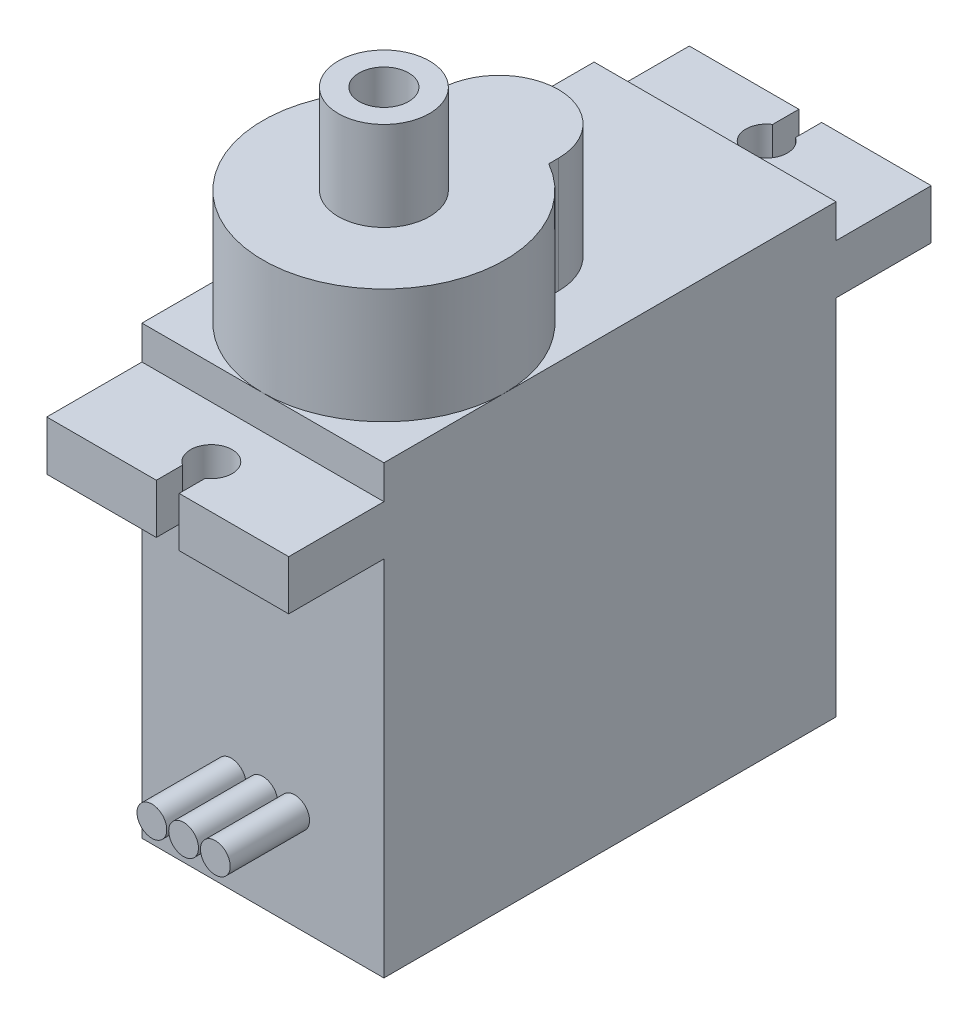
from build123d import *

# Parameters (mm, degrees)
BOSS_EXTRUDE1_DEPTH                 = 12.2
SKETCH2_R                           = 6.1
BOSS_EXTRUDE2_DEPTH                 = 5.8
BOSS_EXTRU_1_DEPTH                  = 5.8
ENL_V_MAT_EXTRU_1_DEPTH             = 30.050301203
SKETCH8_R                           = 0.75
BOSS_EXTRUDE5_DEPTH                 = 4
SKETCH3_R                           = 2.3
BOSS_EXTRUDE6_DEPTH                 = 4.5
DIAM_TRE_DU_PER_AGE_2_5_2_5_1_D     = 2.5
DIAM_TRE_DU_PER_AGE_2_5_2_5_1_DEPTH = 4
DIAM_TRE_DU_PER_AGE_2_5_2_5_1_TIP   = 0.751075774


with BuildPart() as part:
    # Sketch1 → Boss-Extrude1 (new body)
    with BuildSketch(Plane(origin=(0, 0, 0), x_dir=(0, 0, -1), z_dir=(1, 0, 0))):
        Polygon((-11.4, -11.25), (-11.4, 7.05), (-16.2, 7.05), (-16.2, 9.55), (-11.4, 9.55), (-11.4, 11.25), (11.4, 11.25), (11.4, 9.55), (16.2, 9.55), (16.2, 7.05), (11.4, 7.05), (11.4, -11.25), align=None)
    extrude(amount=BOSS_EXTRUDE1_DEPTH)

    # Sketch2 → Boss-Extrude2 (add)
    with BuildSketch(Plane(origin=(0, 11.25, 0), x_dir=(1, 0, 0), z_dir=(0, 1, 0))):
        with Locations(Location((6.1, -5.3, 0), (0, 0, 270))):
            Circle(SKETCH2_R)
    extrude(amount=BOSS_EXTRUDE2_DEPTH)

    # Sketch4 → Boss.-Extru.1 (add)
    with BuildSketch(Plane(origin=(0, 11.25, 0), x_dir=(1, 0, 0), z_dir=(0, 1, 0))):
        with BuildLine():
            Line((3.1, 0.5), (3.1, 0.01130869))
            ThreePointArc((3.1, 0.01130869), (6.1, 0.8), (9.1, 0.01130869))
            Line((9.1, 0.01130869), (9.1, 0.5))
            ThreePointArc((9.1, 0.5), (6.1, 3.5), (3.1, 0.5))
        make_face()
    extrude(amount=BOSS_EXTRU_1_DEPTH)

    # Sketch6 → Enlèv. mat.-Extru.1 (cut, through all)
    with BuildSketch(Plane(origin=(0, 9.55, 0), x_dir=(1, 0, 0), z_dir=(0, 1, 0))):
        with BuildLine():
            Line((5.525, -16.2), (6.675, -16.2))
            Line((6.675, -16.2), (6.675, -14.87856417))
            ThreePointArc((6.675, -14.87856417), (6.1, -12.95), (5.525, -14.87856417))
            Line((5.525, -14.87856417), (5.525, -16.2))
        make_face()
        with BuildLine():
            Line((5.525, 14.87856417), (5.525, 16.2))
            Line((5.525, 16.2), (6.675, 16.2))
            Line((6.675, 16.2), (6.675, 14.87856417))
            ThreePointArc((6.675, 14.87856417), (6.1, 12.95), (5.525, 14.87856417))
        make_face()
    extrude(amount=-ENL_V_MAT_EXTRU_1_DEPTH, mode=Mode.SUBTRACT)

    # Sketch8 → Boss-Extrude5 (add)
    with BuildSketch(Plane.XY.offset(11.4)):
        with Locations(Location((6.1, -6.25, 0), (0, 0, 180))):
            Circle(SKETCH8_R)
        with Locations(Location((7.7, -6.25, 0), (0, 0, 180))):
            Circle(SKETCH8_R)
        with Locations(Location((4.5, -6.25, 0), (0, 0, 180))):
            Circle(SKETCH8_R)
    extrude(amount=BOSS_EXTRUDE5_DEPTH)

    # Sketch3 → Boss-Extrude6 (add)
    with BuildSketch(Plane(origin=(0, 17.05, 0), x_dir=(1, 0, 0), z_dir=(0, 1, 0))):
        with Locations(Location((6.1, -5.3, 0), (0, 0, 270))):
            Circle(SKETCH3_R)
    extrude(amount=BOSS_EXTRUDE6_DEPTH)

    # Diamètre du perçage Ø2.5 (2.5)1
    with Locations(Plane(origin=(0, 21.55, 0), x_dir=(1, 0, 0), z_dir=(0, 1, 0))):
        with Locations((6.1, -5.3)):
            Hole(DIAM_TRE_DU_PER_AGE_2_5_2_5_1_D / 2, depth=DIAM_TRE_DU_PER_AGE_2_5_2_5_1_DEPTH)
            with Locations((0, 0, -(DIAM_TRE_DU_PER_AGE_2_5_2_5_1_DEPTH + DIAM_TRE_DU_PER_AGE_2_5_2_5_1_TIP / 2))):  # 118° drill point
                Cone(0, DIAM_TRE_DU_PER_AGE_2_5_2_5_1_D / 2, DIAM_TRE_DU_PER_AGE_2_5_2_5_1_TIP, mode=Mode.SUBTRACT)


solid = part.part
